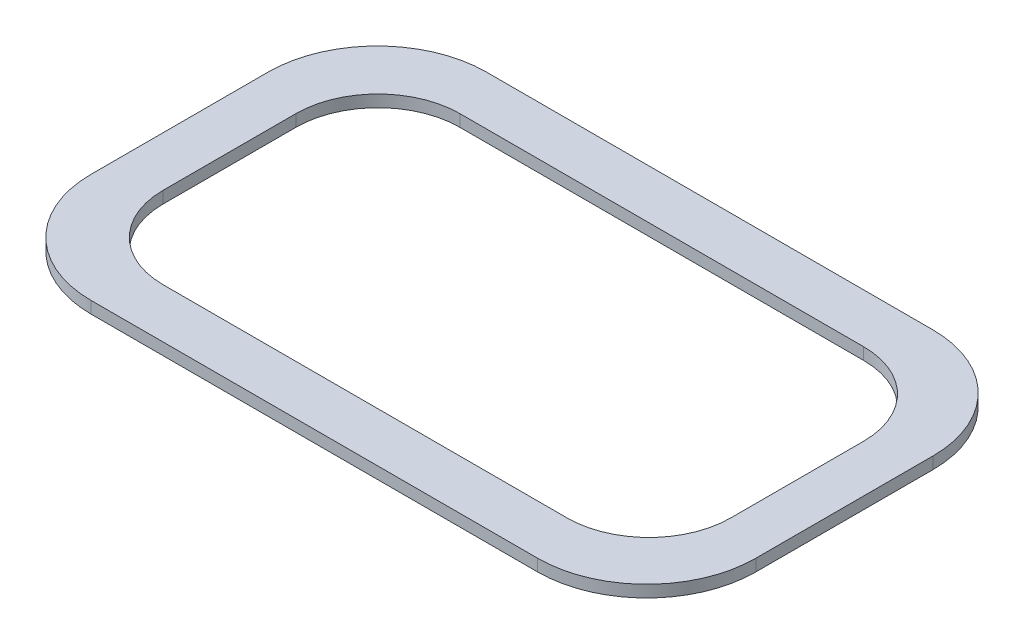
from build123d import *

# Parameters (mm, degrees)
BOSS_EXTRUDE1_DEPTH = 6


with BuildPart() as part:
    # Sketch2 → Boss-Extrude1 (new body)
    with BuildSketch(Plane(origin=(0, 0, 0), x_dir=(1, 0, 0), z_dir=(0, 1, 0))):
        with BuildLine():
            Line((-21.04378644, 31.133869086), (203.98621356, 31.133869086))
            ThreePointArc((203.98621356, 31.133869086), (242.877086526, 15.024742051), (258.98621356, -23.866130914))
            Line((258.98621356, -23.866130914), (258.98621356, -113.126130914))
            ThreePointArc((258.98621356, -113.126130914), (242.877086526, -152.01700388), (203.98621356, -168.126130914))
            Line((203.98621356, -168.126130914), (-21.04378644, -168.126130914))
            ThreePointArc((-21.04378644, -168.126130914), (-59.934659405, -152.01700388), (-76.04378644, -113.126130914))
            Line((-76.04378644, -113.126130914), (-76.04378644, -23.866130914))
            ThreePointArc((-76.04378644, -23.866130914), (-59.934659405, 15.024742051), (-21.04378644, 31.133869086))
        make_face()
        with BuildLine():
            Line((-9.666729832, 6.318869086), (193.844893331, 6.318869086))
            ThreePointArc((193.844893331, 6.318869086), (223.013048055, -5.76297619), (235.094893331, -34.931130914))
            Line((235.094893331, -34.931130914), (235.094893331, -101.876130914))
            ThreePointArc((235.094893331, -101.876130914), (223.013048055, -131.044285638), (193.844893331, -143.126130914))
            Line((193.844893331, -143.126130914), (-9.666729832, -143.126130914))
            ThreePointArc((-9.666729832, -143.126130914), (-38.834884556, -131.044285638), (-50.916729832, -101.876130914))
            Line((-50.916729832, -101.876130914), (-50.916729832, -34.931130914))
            ThreePointArc((-50.916729832, -34.931130914), (-38.834884556, -5.76297619), (-9.666729832, 6.318869086))
        make_face(mode=Mode.SUBTRACT)
    extrude(amount=BOSS_EXTRUDE1_DEPTH)


solid = part.part
